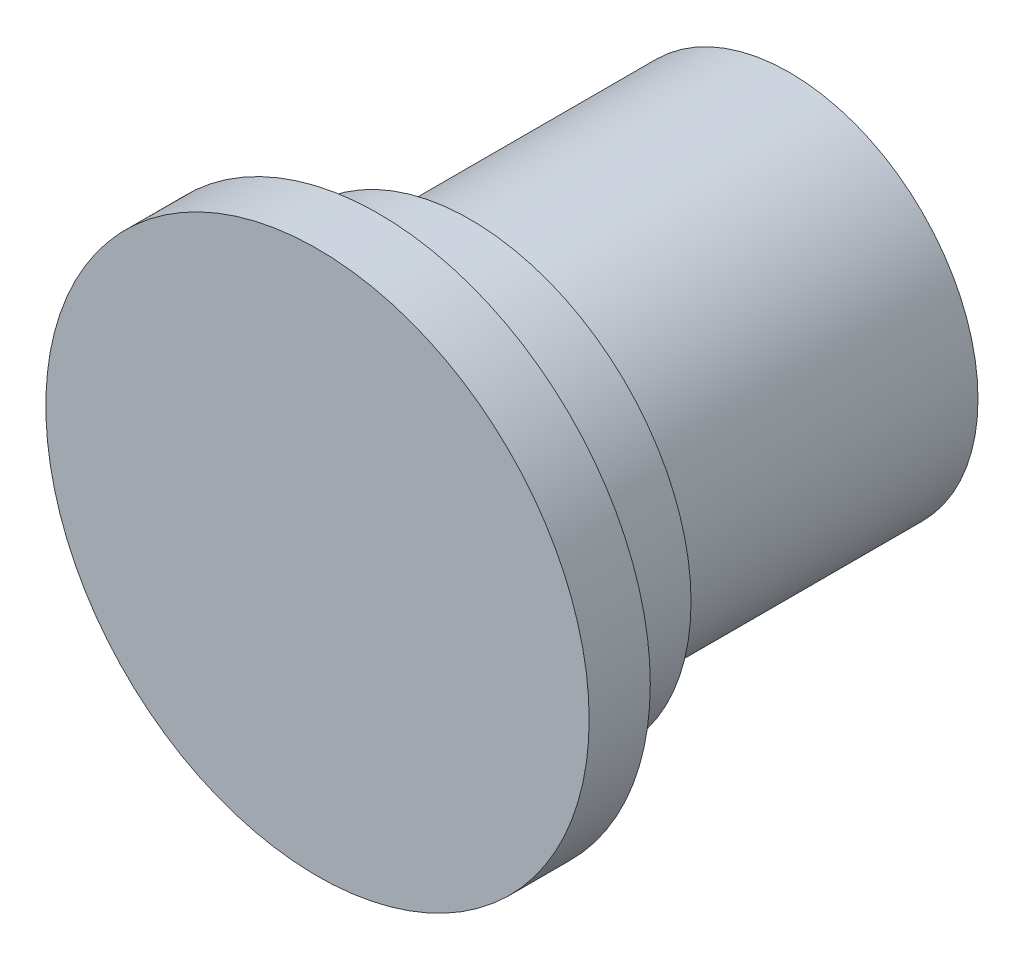
from build123d import *

# Parameters (mm, degrees)
SKETCH1_R           = 8
BOSS_EXTRUDE1_DEPTH = 1.8
SKETCH2_R           = 6.5
BOSS_EXTRUDE2_DEPTH = 2.7
SKETCH3_R           = 5.55
BOSS_EXTRUDE3_DEPTH = 9.4


with BuildPart() as part:
    # Sketch1 → Boss-Extrude1 (new body)
    with BuildSketch(Plane.XY):
        Circle(SKETCH1_R)
    extrude(amount=-BOSS_EXTRUDE1_DEPTH)

    # Sketch2 → Boss-Extrude2 (add)
    with BuildSketch(Plane(origin=(0, 0, -1.8), x_dir=(-1, 0, 0), z_dir=(0, 0, -1))):
        with Locations(Location((0, 0, 0), (0, 0, 180))):
            Circle(SKETCH2_R)
    extrude(amount=BOSS_EXTRUDE2_DEPTH)

    # Sketch3 → Boss-Extrude3 (add)
    with BuildSketch(Plane(origin=(0, 0, -4.5), x_dir=(-1, 0, 0), z_dir=(0, 0, -1))):
        Circle(SKETCH3_R)
    extrude(amount=BOSS_EXTRUDE3_DEPTH)


solid = part.part
